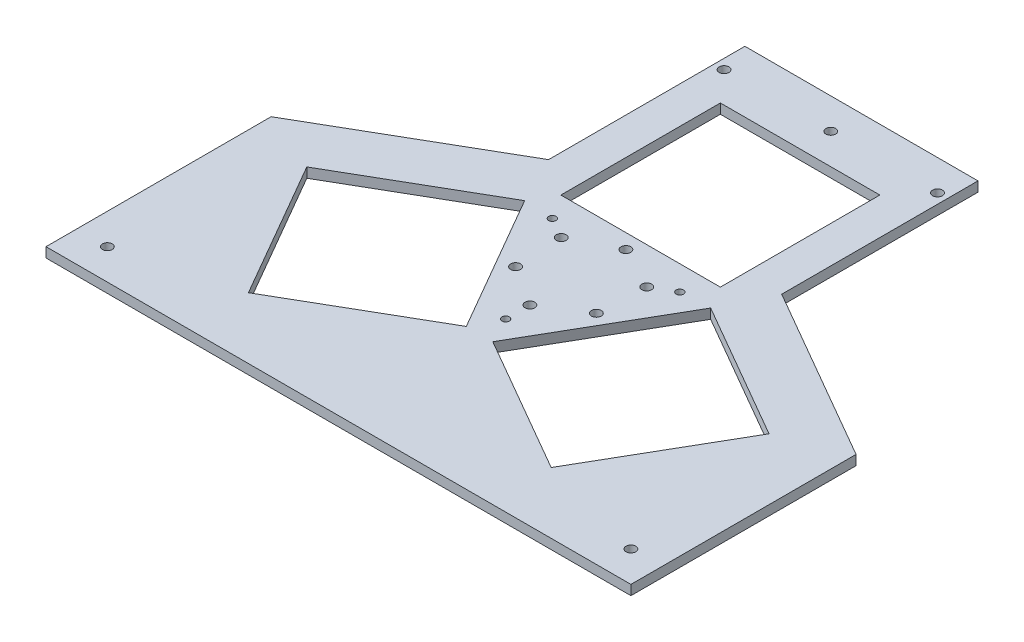
from build123d import *

# Parameters (mm, degrees)
SKETCH_1_R      = 2
SKETCH_1_R_2    = 1.5
SKETCH_1_W      = 65
SKETCH_1_H      = 65
EXTRUDE_1_DEPTH = 4


with BuildPart() as part:
    # 草图1 → 凸台-拉伸1 (new body)
    with BuildSketch(Plane(origin=(0, 0, 0), x_dir=(1, 0, 0), z_dir=(0, 1, 0))):
        Polygon((119.192286341, -98.145825623), (119.192286341, -6.391560818), (47.5, 35), (47.5, 115), (-47.5, 115), (-47.5, 35), (-119.192286341, -6.391560818), (-119.192286341, -98.145825623), align=None)
        with Locations(Location((0, 19, 0), (0, 0, 270))):
            Circle(SKETCH_1_R, mode=Mode.SUBTRACT)
        with Locations(Location((25.980762114, 15, 0), (0, 0, 270))):
            Circle(SKETCH_1_R_2, mode=Mode.SUBTRACT)
        with Locations(Location((16.454482672, -9.5, 0), (0, 0, 270))):
            Circle(SKETCH_1_R, mode=Mode.SUBTRACT)
        with Locations(Location((0, -30, 0), (0, 0, 270))):
            Circle(SKETCH_1_R_2, mode=Mode.SUBTRACT)
        with Locations(Location((-16.454482672, -9.5, 0), (0, 0, 270))):
            Circle(SKETCH_1_R, mode=Mode.SUBTRACT)
        with Locations(Location((-25.980762114, 15, 0), (0, 0, 270))):
            Circle(SKETCH_1_R_2, mode=Mode.SUBTRACT)
        with Locations(Location((0, 102.5, 0), (0, 0, 270))):
            Circle(SKETCH_1_R, mode=Mode.SUBTRACT)
        with Locations(Location((-106.692286341, -85.645825623, 0), (0, 0, 270))):
            Circle(SKETCH_1_R, mode=Mode.SUBTRACT)
        with Locations(Location((106.692286341, -85.645825623, 0), (0, 0, 270))):
            Circle(SKETCH_1_R, mode=Mode.SUBTRACT)
        with Locations(Location((-43.5, 102.5, 0), (0, 0, 270))):
            Circle(SKETCH_1_R, mode=Mode.SUBTRACT)
        with Locations(Location((43.5, 102.5, 0), (0, 0, 270))):
            Circle(SKETCH_1_R, mode=Mode.SUBTRACT)
        with Locations(Location((-17.428761251, 10.0625, 0), (0, 0, 270))):
            Circle(SKETCH_1_R, mode=Mode.SUBTRACT)
        with Locations(Location((17.428761251, 10.0625, 0), (0, 0, 270))):
            Circle(SKETCH_1_R, mode=Mode.SUBTRACT)
        with Locations(Location((0, -20.125, 0), (0, 0, 270))):
            Circle(SKETCH_1_R, mode=Mode.SUBTRACT)
        with Locations((0, 57.5)):
            Rectangle(SKETCH_1_W, SKETCH_1_H, mode=Mode.SUBTRACT)
        Polygon((37.900635095, 15.645825623), (5.400635095, -40.645825623), (61.692286341, -73.145825623), (94.192286341, -16.854174377), align=None, mode=Mode.SUBTRACT)
        Polygon((-5.400635095, -40.645825623), (-37.900635095, 15.645825623), (-94.192286341, -16.854174377), (-61.692286341, -73.145825623), align=None, mode=Mode.SUBTRACT)
    extrude(amount=EXTRUDE_1_DEPTH)


solid = part.part
